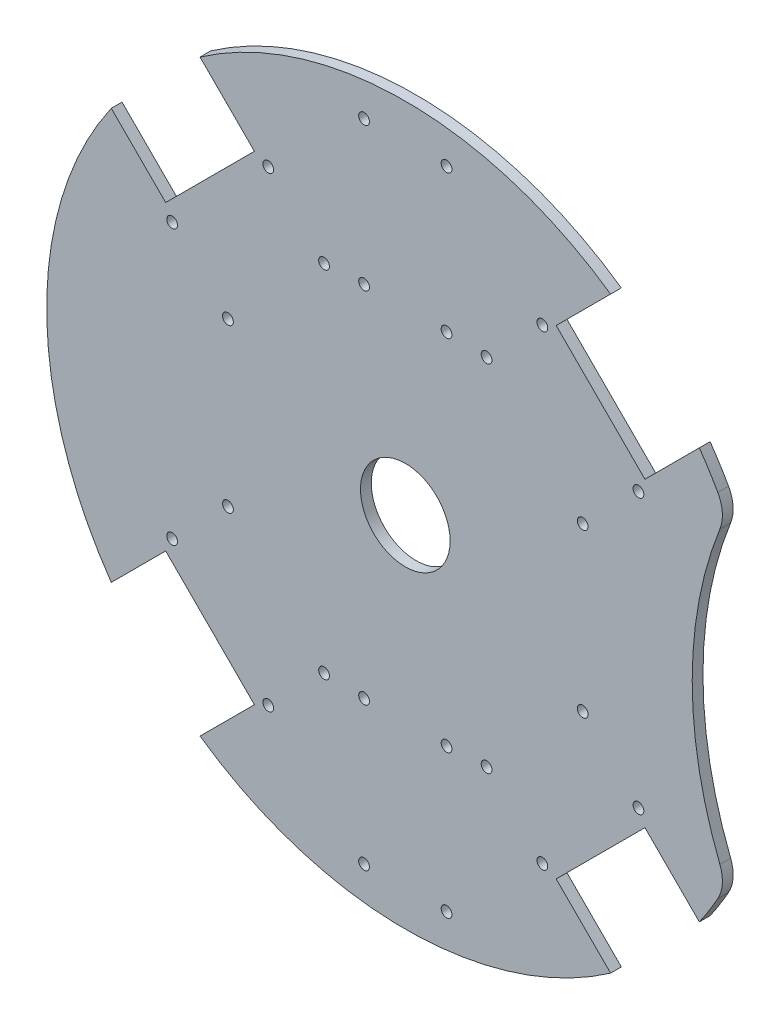
from build123d import *

# Parameters (mm, degrees)
CROQUIS1_R              = 100
SALIENTE_EXTRUIR1_DEPTH = 3
CROQUIS3_R              = 110
CORTAR_EXTRUIR1_DEPTH   = 3
REDONDEO1_R             = 10
CROQUIS4_R              = 1.5
CROQUIS4_R_2            = 12.5
CORTAR_EXTRUIR2_DEPTH   = 142.453172607
CROQUIS5_R              = 1.5
CORTAR_EXTRUIR3_DEPTH   = 142.453172607


with BuildPart() as part:
    # Croquis1 → Saliente-Extruir1 (new body)
    with BuildSketch(Plane.XY):
        Circle(CROQUIS1_R)
    extrude(amount=SALIENTE_EXTRUIR1_DEPTH)

    # Croquis3 → Cortar-Extruir1 (cut)
    with BuildSketch(Plane.XY.offset(3)):
        with Locations((190, 0)):
            Circle(CROQUIS3_R)
    extrude(amount=-CORTAR_EXTRUIR1_DEPTH, mode=Mode.SUBTRACT)

    # Redondeo1
    redondeo1_edges = [part.edges().sort_by_distance(p)[0] for p in [
        (89.473684211, -44.659375654, 1.5),
        (89.473684211, 44.659375654, 1.5),
    ]]
    fillet(redondeo1_edges, radius=REDONDEO1_R)

    # Croquis4 → Cortar-Extruir2 (cut, through all)
    with BuildSketch(Plane.XY.offset(3)):
        with Locations((-65.01846853, -38.219121523)):
            Circle(CROQUIS4_R)
        with Locations((-49.462119344, -22.662772337)):
            Circle(CROQUIS4_R)
        with Locations((-22.662772337, -49.462119344)):
            Circle(CROQUIS4_R)
        with Locations((-38.219121523, -65.01846853)):
            Circle(CROQUIS4_R)
        with Locations((-22.662772337, 49.462119344)):
            Circle(CROQUIS4_R)
        with Locations((-38.219121523, 65.01846853)):
            Circle(CROQUIS4_R)
        with Locations((-49.462119344, 22.662772337)):
            Circle(CROQUIS4_R)
        with Locations((-65.01846853, 38.219121523)):
            Circle(CROQUIS4_R)
        with Locations((49.462119344, 22.662772337)):
            Circle(CROQUIS4_R)
        with Locations((65.01846853, 38.219121523)):
            Circle(CROQUIS4_R)
        with Locations((22.662772337, 49.462119344)):
            Circle(CROQUIS4_R)
        with Locations((38.219121523, 65.01846853)):
            Circle(CROQUIS4_R)
        with Locations((22.662772337, -49.462119344)):
            Circle(CROQUIS4_R)
        with Locations((38.219121523, -65.01846853)):
            Circle(CROQUIS4_R)
        with Locations((49.462119344, -22.662772337)):
            Circle(CROQUIS4_R)
        with Locations((65.01846853, -38.219121523)):
            Circle(CROQUIS4_R)
        Circle(CROQUIS4_R_2)
        Polygon((-58.336309448, -83.085046789), (-83.085046789, -58.336309448), (-66.821590822, -42.072853481), (-42.072853481, -66.821590822), align=None)
        Polygon((-66.821590822, 42.072853481), (-42.072853481, 66.821590822), (-58.336309448, 83.085046789), (-83.085046789, 58.336309448), align=None)
        Polygon((42.072853481, 66.821590822), (66.821590822, 42.072853481), (83.085046789, 58.336309448), (58.336309448, 83.085046789), align=None)
        Polygon((66.821590822, -42.072853481), (42.072853481, -66.821590822), (58.336309448, -83.085046789), (83.085046789, -58.336309448), align=None)
    extrude(amount=-CORTAR_EXTRUIR2_DEPTH, mode=Mode.SUBTRACT)

    # Croquis5 → Cortar-Extruir3 (cut, through all)
    with BuildSketch(Plane(origin=(0, 0, 0), x_dir=(-1, 0, 0), z_dir=(0, 0, -1))):
        with Locations((11.5, -90)):
            Circle(CROQUIS5_R)
        with Locations((-11.5, -90)):
            Circle(CROQUIS5_R)
        with Locations((-11.5, -50)):
            Circle(CROQUIS5_R)
        with Locations((11.5, -50)):
            Circle(CROQUIS5_R)
        with Locations((-11.5, 90)):
            Circle(CROQUIS5_R)
        with Locations((11.5, 90)):
            Circle(CROQUIS5_R)
        with Locations((11.5, 50)):
            Circle(CROQUIS5_R)
        with Locations((-11.5, 50)):
            Circle(CROQUIS5_R)
    extrude(amount=-CORTAR_EXTRUIR3_DEPTH, mode=Mode.SUBTRACT)


solid = part.part
